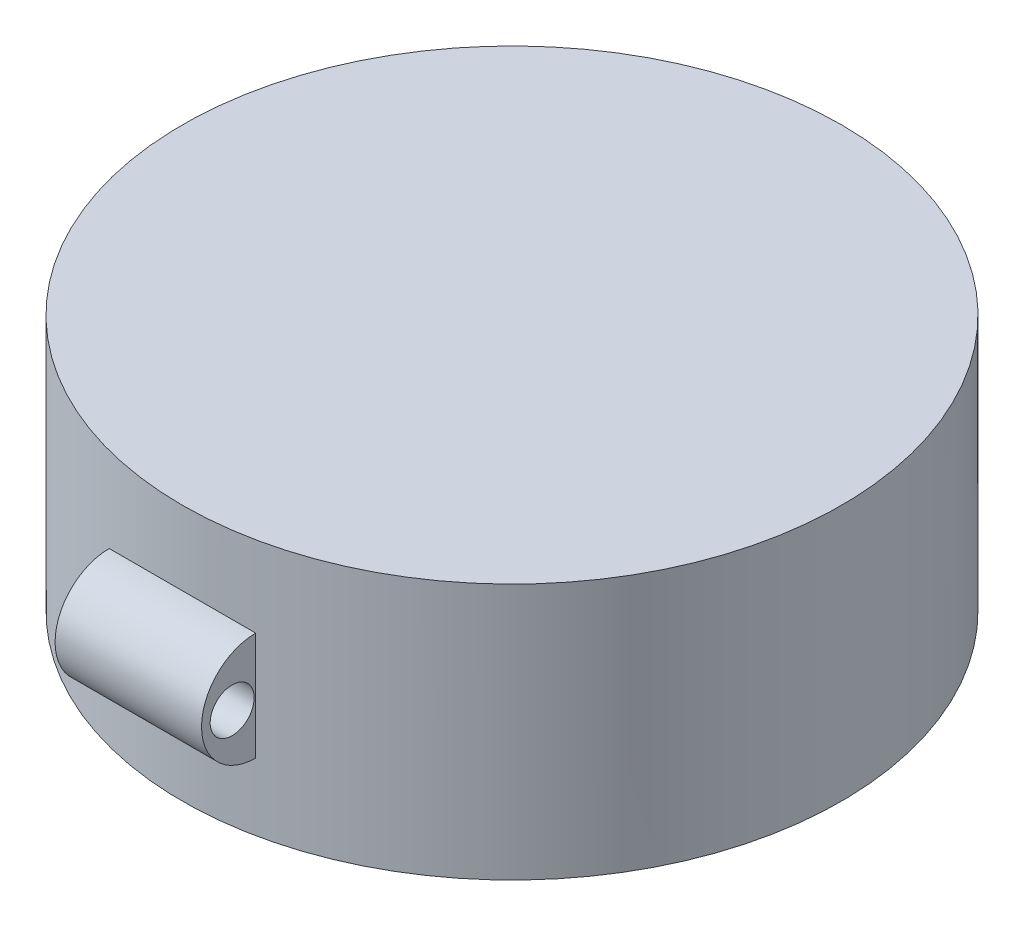
from build123d import *

# Parameters (mm, degrees)
SKETCH1_R             = 45
BOSS_EXTRUDE1_DEPTH   = 20
BOSS_EXTRUDE3_START   = 15
SKETCH9_R             = 45
BOSS_EXTRUDE3_DEPTH   = 15
BOSS_EXTRUDE4_DEPTH   = 10
BOSS_EXTRUDE4_2_DEPTH = 10
SKETCH11_R            = 3.004647084
CUT_EXTRUDE1_DEPTH    = 20


with BuildPart() as part:
    # Sketch1 → Boss-Extrude1 (new body)
    with BuildSketch(Plane(origin=(0, 0, 0), x_dir=(1, 0, 0), z_dir=(0, 1, 0))):
        with Locations(Location((0, 0, 0), (0, 0, 270))):
            Circle(SKETCH1_R)
    extrude(amount=BOSS_EXTRUDE1_DEPTH)

    # Sketch9 → Boss-Extrude3 (add)
    with BuildSketch(Plane.XZ.offset(BOSS_EXTRUDE3_START)):
        with Locations(Location((0, 0, 0), (0, 0, 270))):
            Circle(SKETCH9_R)
    extrude(amount=-BOSS_EXTRUDE3_DEPTH)


with BuildPart() as body_2:
    # Sketch10 → Boss-Extrude4 (new, symmetric)
    with BuildSketch(Plane(origin=(0, 0, 0), x_dir=(0, 0, -1), z_dir=(1, 0, 0))):
        with BuildLine():
            Line((45, 9.890090122), (45, -4.890090122))
            ThreePointArc((45, -4.890090122), (52.390090122, 2.5), (45, 9.890090122))
        make_face()
    extrude(amount=BOSS_EXTRUDE4_DEPTH, both=True)


with BuildPart() as body_3:
    # Sketch10 → Boss-Extrude4 2 (new, symmetric)
    with BuildSketch(Plane(origin=(0, 0, 0), x_dir=(0, 0, -1), z_dir=(1, 0, 0))):
        with BuildLine():
            Line((-45, 9.890090122), (-45, -4.890090122))
            ThreePointArc((-45, -4.890090122), (-52.390090122, 2.5), (-45, 9.890090122))
        make_face()
    extrude(amount=BOSS_EXTRUDE4_2_DEPTH, both=True)


with BuildPart() as cut_extrude1_tool:
    # Sketch11 → Cut-Extrude1 (new body)
    with BuildSketch(Plane(origin=(10, 0, 0), x_dir=(0, 0, -1), z_dir=(1, 0, 0))):
        with Locations((-48.206917235, 2.367401044)):
            Circle(SKETCH11_R)
        with Locations(Location((48.206917235, 2.367401044, 0), (0, 0, 180))):
            Circle(SKETCH11_R)
    extrude(amount=-CUT_EXTRUDE1_DEPTH)


with BuildPart() as body_2_1:
    add(body_2.part)

    # Cut-Extrude1: cut by cut_extrude1_tool
    add(cut_extrude1_tool.part, mode=Mode.SUBTRACT)


with BuildPart() as body_3_1:
    add(body_3.part)

    # Cut-Extrude1: cut by cut_extrude1_tool
    add(cut_extrude1_tool.part, mode=Mode.SUBTRACT)


solid = Compound([part.part, body_2_1.part, body_3_1.part])
